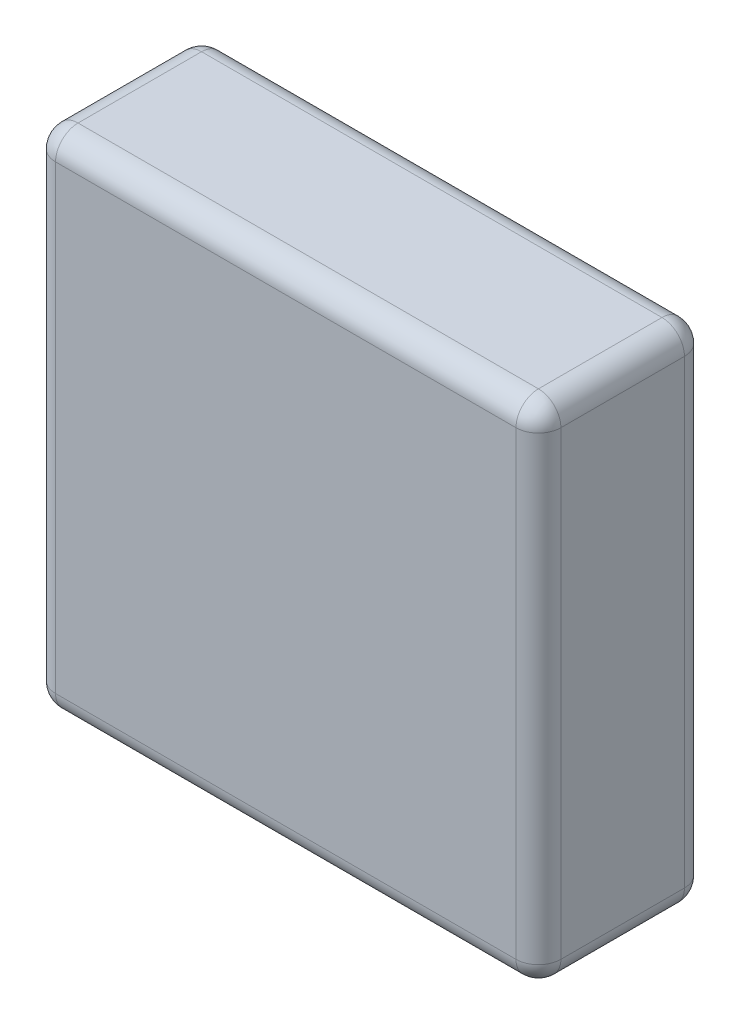
from build123d import *

# Parameters (mm, degrees)
SKETCH_1_W      = 90
SKETCH_1_H      = 90
EXTRUDE_1_DEPTH = 30
FILLET_1_R      = 4


with BuildPart() as part:
    # 草图1 → 凸台-拉伸1 (new body)
    with BuildSketch(Plane.XY):
        Rectangle(SKETCH_1_W, SKETCH_1_H)
    extrude(amount=EXTRUDE_1_DEPTH)

    # 圆角1
    fillet_1_edges = [part.edges().sort_by_distance(p)[0] for p in [
        (-45, 0, 30),
        (0, -45, 30),
        (45, 0, 30),
        (0, -45, 0),
        (-45, 0, 0),
        (0, 45, 0),
        (45, 0, 0),
        (45, -45, 15),
        (-45, -45, 15),
        (-45, 45, 15),
        (45, 45, 15),
        (0, 45, 30),
    ]]
    fillet(fillet_1_edges, radius=FILLET_1_R)


solid = part.part
